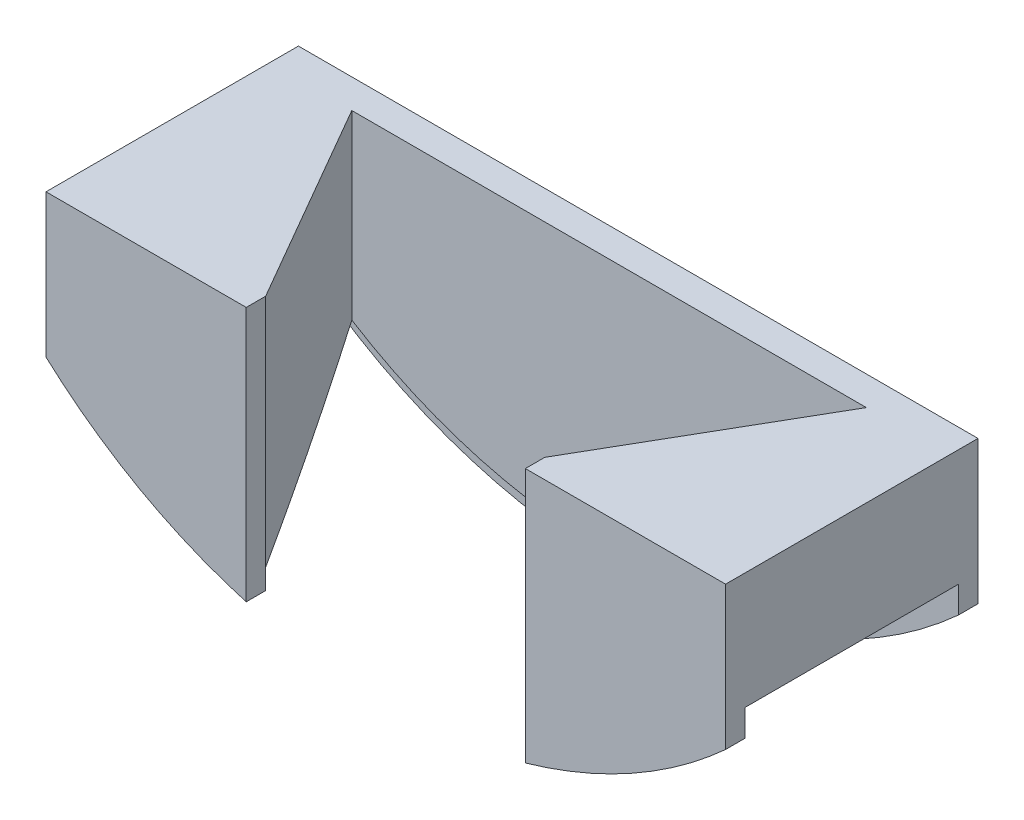
from build123d import *

# Parameters (mm, degrees)
SKETCH1_W            = 35
SKETCH1_H            = 6
BOSS_EXTRUDE1_DEPTH  = 12
BOSS_EXTRUDE2_DEPTH  = 12
SKETCH4_W            = 6
SKETCH4_H            = 13.146428929
CUT_EXTRUDE1_DEPTH   = 8
CUT_EXTRUDE2_DEPTH   = 8
LPATTERN2_COUNT      = 10
LPATTERN2_PITCH      = 2
MIRROR1_COPY_1_DEPTH = 8
MIRROR1_COPY_2_DEPTH = 8
MIRROR1_COPY_3_DEPTH = 8
MIRROR1_COPY_4_DEPTH = 8
MIRROR1_COPY_5_DEPTH = 8
MIRROR1_COPY_6_DEPTH = 8
MIRROR1_COPY_7_DEPTH = 8
MIRROR1_COPY_8_DEPTH = 8
MIRROR1_COPY_9_DEPTH = 8
CUT_EXTRUDE3_DEPTH   = 25.961542292
BOSS_EXTRUDE3_DEPTH  = 1
BOSS_EXTRUDE4_DEPTH  = 1


with BuildPart() as part:
    # Sketch1 → Boss-Extrude1 (new body)
    with BuildSketch(Plane.XY):
        Rectangle(SKETCH1_W, SKETCH1_H)
    extrude(amount=BOSS_EXTRUDE1_DEPTH)

    # Sketch2 → Boss-Extrude2 (add)
    with BuildSketch(Plane.XY.offset(12)):
        with BuildLine():
            Line((-17.5, -3), (17.5, -3))
            ThreePointArc((17.5, -3), (0, -10.146428929), (-17.5, -3))
        make_face()
    extrude(amount=-BOSS_EXTRUDE2_DEPTH)

    # Sketch4 → Cut-Extrude1 (cut)
    with BuildSketch(Plane.XY.offset(12)):
        with Locations((0, -3.573214465)):
            Rectangle(SKETCH4_W, SKETCH4_H)
    extrude(amount=-CUT_EXTRUDE1_DEPTH, mode=Mode.SUBTRACT)

    # Sketch5 → Cut-Extrude2 (cut)
    with BuildSketch(Plane.XY.offset(12)):
        with BuildLine():
            Line((3, 2), (3, 4))
            ThreePointArc((3, 4), (3.084360941, 3.705850588), (3.311797753, 3.501123596))
            ThreePointArc((3.311797753, 3.501123596), (3.461937846, 3.442388286), (3.619565217, 3.408543109))
            ThreePointArc((3.619565217, 3.408543109), (3.712771412, 3.358731646), (3.75, 3.259824575))
            Line((3.75, 3.259824575), (3.75, 2.740175425))
            ThreePointArc((3.75, 2.740175425), (3.712771412, 2.641268354), (3.619565217, 2.591456891))
            ThreePointArc((3.619565217, 2.591456891), (3.461937846, 2.557611714), (3.311797753, 2.498876404))
            ThreePointArc((3.311797753, 2.498876404), (3.084360941, 2.294149412), (3, 2))
        make_face()
    cut_extrude2 = extrude(amount=-CUT_EXTRUDE2_DEPTH, mode=Mode.SUBTRACT)

    # LPattern2: Cut-Extrude2 ×10
    with Locations(*[(0, -i * LPATTERN2_PITCH, 0) for i in range(1, LPATTERN2_COUNT)]):
        add(cut_extrude2, mode=Mode.SUBTRACT)

    # Mirror1: Cut-Extrude2 across plane
    add(cut_extrude2.mirror(Plane(origin=(0, 0, 0), x_dir=(0, 0, 1), z_dir=(1, 0, 0))), mode=Mode.SUBTRACT)

    # Mirror1 copy 1 sketch → Mirror1 copy 1 (cut)
    with BuildSketch(Plane(origin=(0, -2, 12), x_dir=(-1, 0, 0), z_dir=(0, 0, 1))):
        with BuildLine():
            Line((3, -2), (3, -4))
            ThreePointArc((3, -4), (3.084360941, -3.705850588), (3.311797753, -3.501123596))
            ThreePointArc((3.311797753, -3.501123596), (3.461937846, -3.442388286), (3.619565217, -3.408543109))
            ThreePointArc((3.619565217, -3.408543109), (3.712771412, -3.358731646), (3.75, -3.259824575))
            Line((3.75, -3.259824575), (3.75, -2.740175425))
            ThreePointArc((3.75, -2.740175425), (3.712771412, -2.641268354), (3.619565217, -2.591456891))
            ThreePointArc((3.619565217, -2.591456891), (3.461937846, -2.557611714), (3.311797753, -2.498876404))
            ThreePointArc((3.311797753, -2.498876404), (3.084360941, -2.294149412), (3, -2))
        make_face()
    extrude(amount=-MIRROR1_COPY_1_DEPTH, mode=Mode.SUBTRACT)

    # Mirror1 copy 2 sketch → Mirror1 copy 2 (cut)
    with BuildSketch(Plane(origin=(0, -4, 12), x_dir=(-1, 0, 0), z_dir=(0, 0, 1))):
        with BuildLine():
            Line((3, -2), (3, -4))
            ThreePointArc((3, -4), (3.084360941, -3.705850588), (3.311797753, -3.501123596))
            ThreePointArc((3.311797753, -3.501123596), (3.461937846, -3.442388286), (3.619565217, -3.408543109))
            ThreePointArc((3.619565217, -3.408543109), (3.712771412, -3.358731646), (3.75, -3.259824575))
            Line((3.75, -3.259824575), (3.75, -2.740175425))
            ThreePointArc((3.75, -2.740175425), (3.712771412, -2.641268354), (3.619565217, -2.591456891))
            ThreePointArc((3.619565217, -2.591456891), (3.461937846, -2.557611714), (3.311797753, -2.498876404))
            ThreePointArc((3.311797753, -2.498876404), (3.084360941, -2.294149412), (3, -2))
        make_face()
    extrude(amount=-MIRROR1_COPY_2_DEPTH, mode=Mode.SUBTRACT)

    # Mirror1 copy 3 sketch → Mirror1 copy 3 (cut)
    with BuildSketch(Plane(origin=(0, -6, 12), x_dir=(-1, 0, 0), z_dir=(0, 0, 1))):
        with BuildLine():
            Line((3, -2), (3, -4))
            ThreePointArc((3, -4), (3.084360941, -3.705850588), (3.311797753, -3.501123596))
            ThreePointArc((3.311797753, -3.501123596), (3.461937846, -3.442388286), (3.619565217, -3.408543109))
            ThreePointArc((3.619565217, -3.408543109), (3.712771412, -3.358731646), (3.75, -3.259824575))
            Line((3.75, -3.259824575), (3.75, -2.740175425))
            ThreePointArc((3.75, -2.740175425), (3.712771412, -2.641268354), (3.619565217, -2.591456891))
            ThreePointArc((3.619565217, -2.591456891), (3.461937846, -2.557611714), (3.311797753, -2.498876404))
            ThreePointArc((3.311797753, -2.498876404), (3.084360941, -2.294149412), (3, -2))
        make_face()
    extrude(amount=-MIRROR1_COPY_3_DEPTH, mode=Mode.SUBTRACT)

    # Mirror1 copy 4 sketch → Mirror1 copy 4 (cut)
    with BuildSketch(Plane(origin=(0, -8, 12), x_dir=(-1, 0, 0), z_dir=(0, 0, 1))):
        with BuildLine():
            Line((3, -2), (3, -4))
            ThreePointArc((3, -4), (3.084360941, -3.705850588), (3.311797753, -3.501123596))
            ThreePointArc((3.311797753, -3.501123596), (3.461937846, -3.442388286), (3.619565217, -3.408543109))
            ThreePointArc((3.619565217, -3.408543109), (3.712771412, -3.358731646), (3.75, -3.259824575))
            Line((3.75, -3.259824575), (3.75, -2.740175425))
            ThreePointArc((3.75, -2.740175425), (3.712771412, -2.641268354), (3.619565217, -2.591456891))
            ThreePointArc((3.619565217, -2.591456891), (3.461937846, -2.557611714), (3.311797753, -2.498876404))
            ThreePointArc((3.311797753, -2.498876404), (3.084360941, -2.294149412), (3, -2))
        make_face()
    extrude(amount=-MIRROR1_COPY_4_DEPTH, mode=Mode.SUBTRACT)

    # Mirror1 copy 5 sketch → Mirror1 copy 5 (cut)
    with BuildSketch(Plane(origin=(0, -10, 12), x_dir=(-1, 0, 0), z_dir=(0, 0, 1))):
        with BuildLine():
            Line((3, -2), (3, -4))
            ThreePointArc((3, -4), (3.084360941, -3.705850588), (3.311797753, -3.501123596))
            ThreePointArc((3.311797753, -3.501123596), (3.461937846, -3.442388286), (3.619565217, -3.408543109))
            ThreePointArc((3.619565217, -3.408543109), (3.712771412, -3.358731646), (3.75, -3.259824575))
            Line((3.75, -3.259824575), (3.75, -2.740175425))
            ThreePointArc((3.75, -2.740175425), (3.712771412, -2.641268354), (3.619565217, -2.591456891))
            ThreePointArc((3.619565217, -2.591456891), (3.461937846, -2.557611714), (3.311797753, -2.498876404))
            ThreePointArc((3.311797753, -2.498876404), (3.084360941, -2.294149412), (3, -2))
        make_face()
    extrude(amount=-MIRROR1_COPY_5_DEPTH, mode=Mode.SUBTRACT)

    # Mirror1 copy 6 sketch → Mirror1 copy 6 (cut)
    with BuildSketch(Plane(origin=(0, -12, 12), x_dir=(-1, 0, 0), z_dir=(0, 0, 1))):
        with BuildLine():
            Line((3, -2), (3, -4))
            ThreePointArc((3, -4), (3.084360941, -3.705850588), (3.311797753, -3.501123596))
            ThreePointArc((3.311797753, -3.501123596), (3.461937846, -3.442388286), (3.619565217, -3.408543109))
            ThreePointArc((3.619565217, -3.408543109), (3.712771412, -3.358731646), (3.75, -3.259824575))
            Line((3.75, -3.259824575), (3.75, -2.740175425))
            ThreePointArc((3.75, -2.740175425), (3.712771412, -2.641268354), (3.619565217, -2.591456891))
            ThreePointArc((3.619565217, -2.591456891), (3.461937846, -2.557611714), (3.311797753, -2.498876404))
            ThreePointArc((3.311797753, -2.498876404), (3.084360941, -2.294149412), (3, -2))
        make_face()
    extrude(amount=-MIRROR1_COPY_6_DEPTH, mode=Mode.SUBTRACT)

    # Mirror1 copy 7 sketch → Mirror1 copy 7 (cut)
    with BuildSketch(Plane(origin=(0, -14, 12), x_dir=(-1, 0, 0), z_dir=(0, 0, 1))):
        with BuildLine():
            Line((3, -2), (3, -4))
            ThreePointArc((3, -4), (3.084360941, -3.705850588), (3.311797753, -3.501123596))
            ThreePointArc((3.311797753, -3.501123596), (3.461937846, -3.442388286), (3.619565217, -3.408543109))
            ThreePointArc((3.619565217, -3.408543109), (3.712771412, -3.358731646), (3.75, -3.259824575))
            Line((3.75, -3.259824575), (3.75, -2.740175425))
            ThreePointArc((3.75, -2.740175425), (3.712771412, -2.641268354), (3.619565217, -2.591456891))
            ThreePointArc((3.619565217, -2.591456891), (3.461937846, -2.557611714), (3.311797753, -2.498876404))
            ThreePointArc((3.311797753, -2.498876404), (3.084360941, -2.294149412), (3, -2))
        make_face()
    extrude(amount=-MIRROR1_COPY_7_DEPTH, mode=Mode.SUBTRACT)

    # Mirror1 copy 8 sketch → Mirror1 copy 8 (cut)
    with BuildSketch(Plane(origin=(0, -16, 12), x_dir=(-1, 0, 0), z_dir=(0, 0, 1))):
        with BuildLine():
            Line((3, -2), (3, -4))
            ThreePointArc((3, -4), (3.084360941, -3.705850588), (3.311797753, -3.501123596))
            ThreePointArc((3.311797753, -3.501123596), (3.461937846, -3.442388286), (3.619565217, -3.408543109))
            ThreePointArc((3.619565217, -3.408543109), (3.712771412, -3.358731646), (3.75, -3.259824575))
            Line((3.75, -3.259824575), (3.75, -2.740175425))
            ThreePointArc((3.75, -2.740175425), (3.712771412, -2.641268354), (3.619565217, -2.591456891))
            ThreePointArc((3.619565217, -2.591456891), (3.461937846, -2.557611714), (3.311797753, -2.498876404))
            ThreePointArc((3.311797753, -2.498876404), (3.084360941, -2.294149412), (3, -2))
        make_face()
    extrude(amount=-MIRROR1_COPY_8_DEPTH, mode=Mode.SUBTRACT)

    # Mirror1 copy 9 sketch → Mirror1 copy 9 (cut)
    with BuildSketch(Plane(origin=(0, -18, 12), x_dir=(-1, 0, 0), z_dir=(0, 0, 1))):
        with BuildLine():
            Line((3, -2), (3, -4))
            ThreePointArc((3, -4), (3.084360941, -3.705850588), (3.311797753, -3.501123596))
            ThreePointArc((3.311797753, -3.501123596), (3.461937846, -3.442388286), (3.619565217, -3.408543109))
            ThreePointArc((3.619565217, -3.408543109), (3.712771412, -3.358731646), (3.75, -3.259824575))
            Line((3.75, -3.259824575), (3.75, -2.740175425))
            ThreePointArc((3.75, -2.740175425), (3.712771412, -2.641268354), (3.619565217, -2.591456891))
            ThreePointArc((3.619565217, -2.591456891), (3.461937846, -2.557611714), (3.311797753, -2.498876404))
            ThreePointArc((3.311797753, -2.498876404), (3.084360941, -2.294149412), (3, -2))
        make_face()
    extrude(amount=-MIRROR1_COPY_9_DEPTH, mode=Mode.SUBTRACT)

    # Sketch6 → Cut-Extrude3 (cut, through all)
    with BuildSketch(Plane(origin=(0, 3, 0), x_dir=(1, 0, 0), z_dir=(0, 1, 0))):
        Polygon((7.187822174, -12), (-7.187822174, -12), (-13.25, -1.5), (13.25, -1.5), align=None)
    extrude(amount=-CUT_EXTRUDE3_DEPTH, mode=Mode.SUBTRACT)

    # Sketch7 → Boss-Extrude3 (add)
    with BuildSketch(Plane.XY.offset(12)):
        with BuildLine():
            Line((17.5, 3), (7.187822174, 3))
            Line((7.187822174, 3), (7.187822174, -10.133129639))
            ThreePointArc((7.187822174, -10.133129639), (12.675182552, -7.847524657), (17.5, -4.375313452))
            Line((17.5, -4.375313452), (17.5, 3))
        make_face()
    boss_extrude3 = extrude(amount=BOSS_EXTRUDE3_DEPTH)

    # Mirror2: Boss-Extrude3 across plane
    add(boss_extrude3.mirror(Plane(origin=(0, 0, 0), x_dir=(0, 0, 1), z_dir=(1, 0, 0))))

    # Sketch8 → Boss-Extrude4 (add)
    with BuildSketch(Plane(origin=(0, 0, 0), x_dir=(-1, 0, 0), z_dir=(0, 0, -1))):
        with BuildLine():
            Line((17.5, -4.375313452), (17.5, -3))
            ThreePointArc((17.5, -3), (0, -10.146428929), (-17.5, -3))
            Line((-17.5, -3), (-17.5, -4.375313452))
            ThreePointArc((-17.5, -4.375313452), (0, -11.146428929), (17.5, -4.375313452))
        make_face()
    extrude(amount=-BOSS_EXTRUDE4_DEPTH)


solid = part.part
